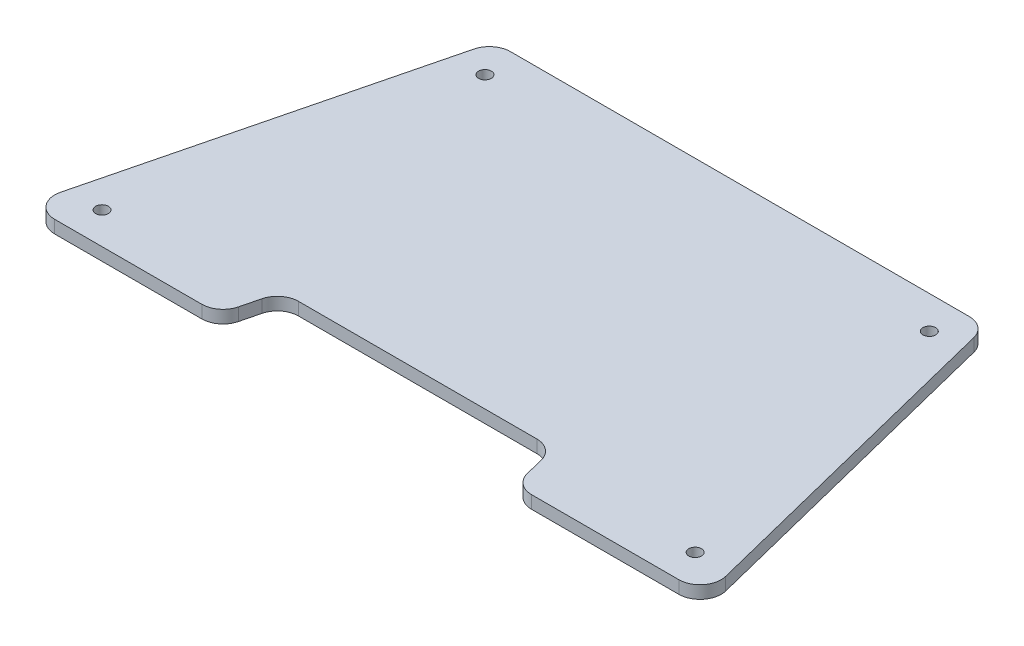
from build123d import *

# Parameters (mm, degrees)
Y_KSEKLIK_EKSTR_ZYON1_DEPTH = 3
IZIM2_R                     = 1.5
KES_EKSTR_ZYON1_DEPTH       = 10
IZIM4_R                     = 1.5
KES_EKSTR_ZYON2_DEPTH       = 10


with BuildPart() as part:
    # Çizim1 → Yükseklik-Ekstrüzyon1 (new body)
    with BuildSketch(Plane(origin=(0, 0, 0), x_dir=(1, 0, 0), z_dir=(0, 1, 0))):
        with BuildLine():
            Line((3.903882032, 0), (112.096117968, 0))
            ThreePointArc((112.096117968, 0), (115.173179015, -1.05897281), (116.946830469, -3.787321875))
            Line((116.946830469, -3.787321875), (136.446830469, -81.787321875))
            ThreePointArc((136.446830469, -81.787321875), (135.537145158, -86.077061047), (131.596117968, -88))
            Line((131.596117968, -88), (96.903882032, -88))
            ThreePointArc((96.903882032, -88), (93.826820985, -86.94102719), (92.053169531, -84.212678125))
            Line((92.053169531, -84.212678125), (90.946830469, -79.787321875))
            ThreePointArc((90.946830469, -79.787321875), (89.173179015, -77.05897281), (86.096117968, -76))
            Line((86.096117968, -76), (29.903882032, -76))
            ThreePointArc((29.903882032, -76), (26.826820985, -77.05897281), (25.053169531, -79.787321875))
            Line((25.053169531, -79.787321875), (23.946830469, -84.212678125))
            ThreePointArc((23.946830469, -84.212678125), (22.173179015, -86.94102719), (19.096117968, -88))
            Line((19.096117968, -88), (-15.596117968, -88))
            ThreePointArc((-15.596117968, -88), (-19.537145158, -86.077061047), (-20.446830469, -81.787321875))
            Line((-20.446830469, -81.787321875), (-0.946830469, -3.787321875))
            ThreePointArc((-0.946830469, -3.787321875), (0.826820985, -1.05897281), (3.903882032, 0))
        make_face()
    extrude(amount=Y_KSEKLIK_EKSTR_ZYON1_DEPTH)

    # Çizim2 → Kes-Ekstrüzyon1 (cut)
    with BuildSketch(Plane(origin=(0, 3, 0), x_dir=(1, 0, 0), z_dir=(0, 1, 0))):
        with Locations(Location((5.6, -7.73, 0), (0, 0, 270))):
            Circle(IZIM2_R)
        with Locations(Location((110.4, -7.73, 0), (0, 0, 90))):
            Circle(IZIM2_R)
    extrude(amount=-KES_EKSTR_ZYON1_DEPTH, mode=Mode.SUBTRACT)

    # Çizim4 → Kes-Ekstrüzyon2 (cut)
    with BuildSketch(Plane(origin=(0, 3, 0), x_dir=(1, 0, 0), z_dir=(0, 1, 0))):
        with Locations(Location((-11.94, -80.5, 0), (0, 0, 270))):
            Circle(IZIM4_R)
        with Locations(Location((127.94, -80.5, 0), (0, 0, 90))):
            Circle(IZIM4_R)
    extrude(amount=-KES_EKSTR_ZYON2_DEPTH, mode=Mode.SUBTRACT)


solid = part.part
